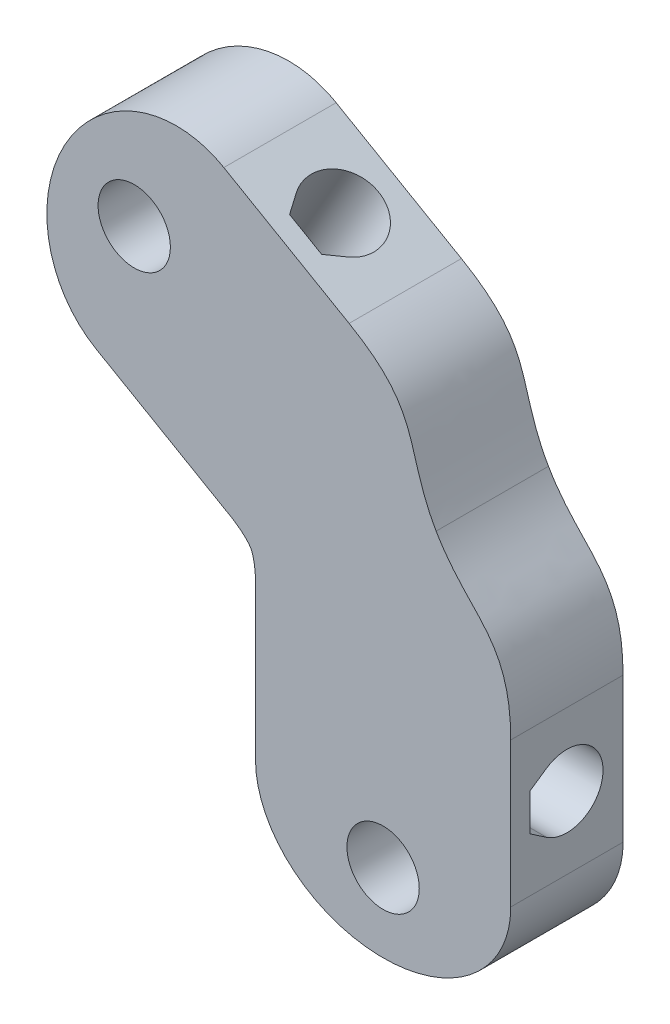
from build123d import *

# Parameters (mm, degrees)
SCHIZZO1_R                   = 4.25
ESTRUSIONE_ESTRUSIONE1_DEPTH = 6.6
TAGLIO_ESTRUSIONE1_REACH     = 71.721
TAGLIO_ESTRUSIONE2_REACH     = 75.377


with BuildPart() as part:
    # Schizzo1 → Estrusione-Estrusione1 (new, symmetric)
    with BuildSketch(Plane.XY):
        with BuildLine():
            add(Edge.make_bspline(
                [(-15, -13.274990748), (-14.891344954, -10.915764128), (-15.24029042, -9.579342295), (-15.578194705, -8.994074906)],
                knots=[0, 0, 0, 0, 1, 1, 1, 1], degree=3))
            Line((-15, -13.274990748), (-15, -30.274990748))
            add(Edge.make_bspline(
                [(-15, -30.274990748), (-15, -42.955990748), (0, -42.955990748), (15, -42.955990748), (15, -30.274990748)],
                knots=[3.141592654, 3.141592654, 3.141592654, 4.71238898, 4.71238898, 6.283185307, 6.283185307, 6.283185307], degree=2, weights=[1, 0.707106781, 1, 0.707106781, 1]))
            Line((15, -30.274990748), (15, -13.274990748))
            add(Edge.make_bspline(
                [(15, -13.274990748), (15, -3.027964059), (10.106357097, -3.104514731), (6.235473511, 3.60005231)],
                knots=[0, 0, 0, 0, 1, 1, 1, 1], degree=3))
            add(Edge.make_bspline(
                [(-3.996479222, 19.627876431), (4.877706203, 14.504363086), (2.364589925, 10.304619352), (6.235473511, 3.60005231)],
                knots=[0, 0, 0, 0, 1, 1, 1, 1], degree=3))
            Line((-3.996479222, 19.627876431), (-18.718911087, 28.127876431))
            add(Edge.make_bspline(
                [(-18.718911087, 28.127876431), (-29.700979232, 34.468376431), (-37.200979232, 21.477995374), (-44.700979232, 8.487614317), (-33.718911087, 2.147114317)],
                knots=[0, 0, 0, 1.570796327, 1.570796327, 3.141592654, 3.141592654, 3.141592654], degree=2, weights=[1, 0.707106781, 1, 0.707106781, 1]))
            Line((-33.718911087, 2.147114317), (-18.996479222, -6.352885683))
            add(Edge.make_bspline(
                [(-18.996479222, -6.352885683), (-16.899001514, -7.438400962), (-15.916098989, -8.408807517), (-15.578194705, -8.994074906)],
                knots=[0, 0, 0, 0, 1, 1, 1, 1], degree=3))
        make_face()
        with Locations((0, -33.774990748)):
            Circle(SCHIZZO1_R, mode=Mode.SUBTRACT)
        with Locations((-29.25, 16.887495374)):
            Circle(SCHIZZO1_R, mode=Mode.SUBTRACT)
    extrude(amount=ESTRUSIONE_ESTRUSIONE1_DEPTH, both=True)

    # Schizzo11 → Taglio-Estrusione1 (cut, up to next)
    with BuildSketch(Plane(origin=(15, 0, 0), x_dir=(0, 0, -1), z_dir=(1, 0, 0)), mode=Mode.PRIVATE) as taglio_estrusione1_sk1:
        with BuildLine():
            Line((-4.35, -23.949990748), (-4.35, -19.599990748))
            Line((-4.35, -19.599990748), (-2.39780105, -18.265995147))
            ThreePointArc((-2.39780105, -18.265995147), (4.25, -21.774990748), (-2.39780105, -25.283986348))
            Line((-2.39780105, -25.283986348), (-4.35, -23.949990748))
        make_face()
    taglio_estrusione1_tool1 = extrude(taglio_estrusione1_sk1.sketch, amount=-TAGLIO_ESTRUSIONE1_REACH, mode=Mode.PRIVATE) & part.part
    add(taglio_estrusione1_tool1.solids().sort_by_distance((15, -21.774991, 0.13262))[0], mode=Mode.SUBTRACT)

    # Schizzo12 → Taglio-Estrusione2 (cut, up to next)
    with BuildSketch(Plane(origin=(7.5, 12.990381057, 0), x_dir=(0.8660254037844413, -0.49999999999999556, 0), z_dir=(0.49999999999999556, 0.8660254037844413, 0)), mode=Mode.PRIVATE) as taglio_estrusione2_sk1:
        with BuildLine():
            Line((-19.599990748, -4.35), (-23.949990748, -4.35))
            Line((-23.949990748, -4.35), (-25.283986348, -2.39780105))
            ThreePointArc((-25.283986348, -2.39780105), (-21.774990748, 4.25), (-18.265995147, -2.39780105))
            Line((-18.265995147, -2.39780105), (-19.599990748, -4.35))
        make_face()
    taglio_estrusione2_tool1 = extrude(taglio_estrusione2_sk1.sketch, amount=-TAGLIO_ESTRUSIONE2_REACH, mode=Mode.PRIVATE) & part.part
    add(taglio_estrusione2_tool1.solids().sort_by_distance((-11.357695, 23.877876, 0.13262))[0], mode=Mode.SUBTRACT)


solid = part.part
